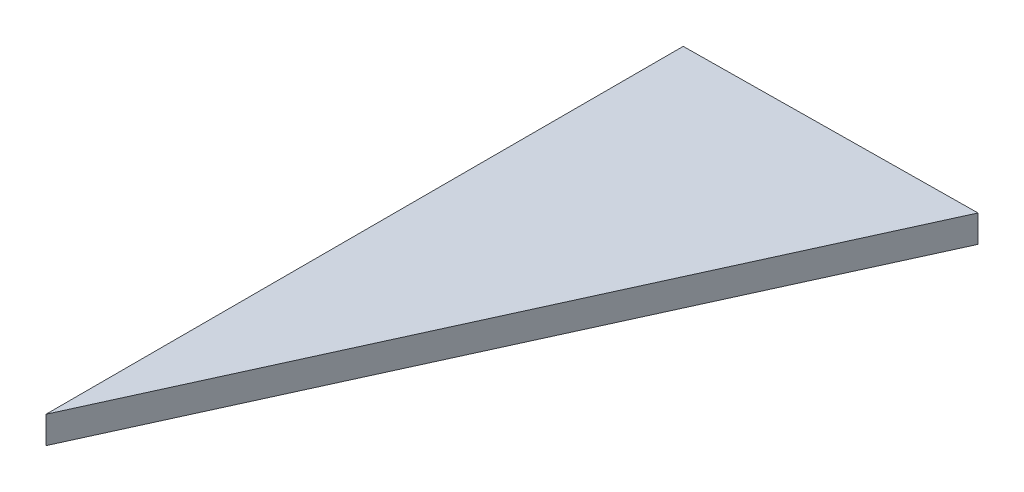
from build123d import *

# Parameters (mm, degrees)
SKETCH1_W           = 263.3434916
SKETCH1_H           = 204.19140391
BOSS_EXTRUDE1_DEPTH = 4.599999944
SKETCH2_OUTSIDE_W   = 331.995
SKETCH2_OUTSIDE_H   = 272.843
CUT_EXTRUDE1_DEPTH  = 334.264285513


with BuildPart() as part:
    # Sketch1 → Boss-Extrude1 (new body)
    with BuildSketch(Plane(origin=(0, 0, 0), x_dir=(1, 0, 0), z_dir=(0, 1, 0))):
        with Locations((131.6717458, 102.095701955)):
            Rectangle(SKETCH1_W, SKETCH1_H)
    extrude(amount=BOSS_EXTRUDE1_DEPTH)

    # Sketch2 outside → Cut-Extrude1 (cut, through all)
    with BuildSketch(Plane(origin=(0, 4.599999944, 0), x_dir=(1, 0, 0), z_dir=(0, 1, 0))):
        with Locations((131.6715, 102.0955)):
            Rectangle(SKETCH2_OUTSIDE_W, SKETCH2_OUTSIDE_H)
        Polygon((0, 127.682281545), (0, 19.986281545), (49.297542197, 128.208974474), align=None, mode=Mode.SUBTRACT)
    extrude(amount=-CUT_EXTRUDE1_DEPTH, mode=Mode.SUBTRACT)


solid = part.part
